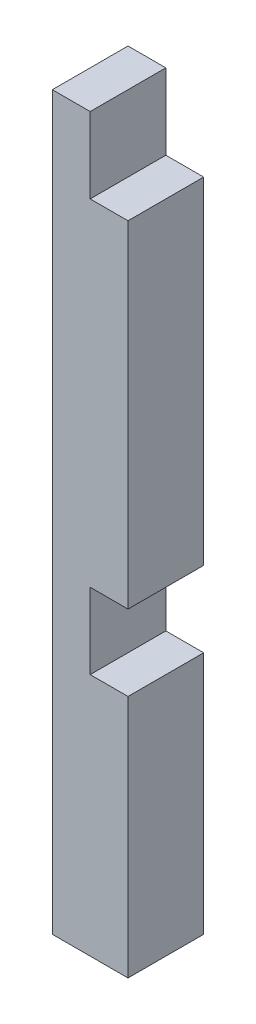
from build123d import *

# Parameters (mm, degrees)
SKETCH2_W           = 90
SKETCH2_H           = 90
BOSS_EXTRUDE1_DEPTH = 870
SKETCH3_W           = 90
SKETCH3_H           = 90
CUT_EXTRUDE1_DEPTH  = 45


with BuildPart() as part:
    # Sketch2 → Boss-Extrude1 (new body)
    with BuildSketch(Plane(origin=(0, 0, 0), x_dir=(1, 0, 0), z_dir=(0, 1, 0))):
        with Locations((45, 45)):
            Rectangle(SKETCH2_W, SKETCH2_H)
    extrude(amount=BOSS_EXTRUDE1_DEPTH)

    # Sketch3 → Cut-Extrude1 (cut)
    with BuildSketch(Plane(origin=(90, 0, 0), x_dir=(0, 0, -1), z_dir=(1, 0, 0))):
        with Locations((45, 825)):
            Rectangle(SKETCH3_W, SKETCH3_H)
        with Locations((45, 335)):
            Rectangle(SKETCH3_W, SKETCH3_H)
    extrude(amount=-CUT_EXTRUDE1_DEPTH, mode=Mode.SUBTRACT)


solid = part.part
